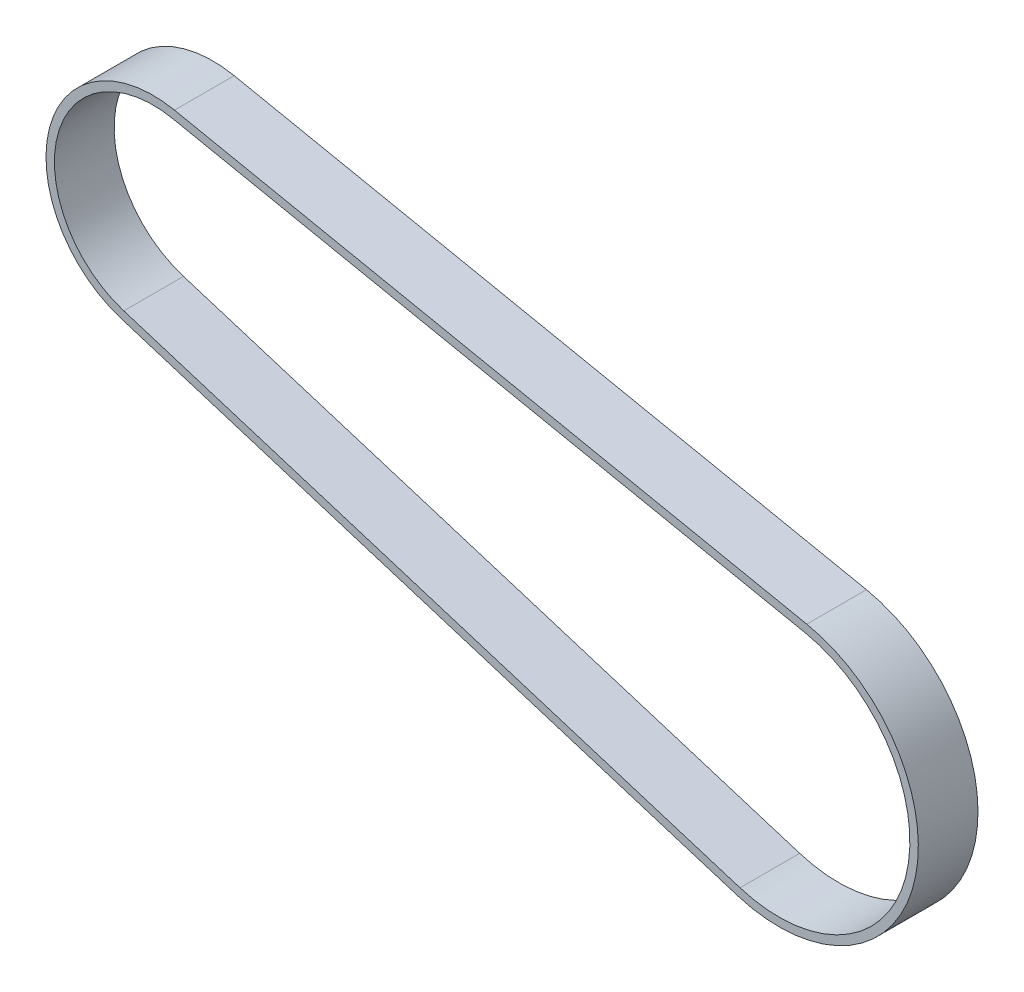
from build123d import *

# Parameters (mm, degrees)
EXTRUDE_THIN1_DEPTH = 9


with BuildPart() as part:
    # Sketch2 → Extrude-Thin1 (new body)
    with BuildSketch(Plane.XY):
        with BuildLine():
            Line((101.620423164, -46.173092679), (8.717895502, -17.295897894))
            ThreePointArc((8.717895502, -17.295897894), (-2.129340177, 2.139529558), (16.739167239, 13.945366673))
            Line((16.739167239, 13.945366673), (112.062109612, -5.504792249))
            ThreePointArc((112.062109612, -5.504792249), (128.219313862, -31.327808884), (101.620423164, -46.173092679))
        make_face()
        with BuildLine():
            Line((101.997390434, -44.960329026), (9.094862772, -16.083134241))
            ThreePointArc((9.094862772, -16.083134241), (-0.899238409, 1.823697895), (16.485261922, 12.701006561))
            Line((16.485261922, 12.701006561), (111.808204295, -6.749152361))
            ThreePointArc((111.808204295, -6.749152361), (126.989212094, -31.011977221), (101.997390434, -44.960329026))
        make_face(mode=Mode.SUBTRACT)
    extrude(amount=EXTRUDE_THIN1_DEPTH)


solid = part.part
